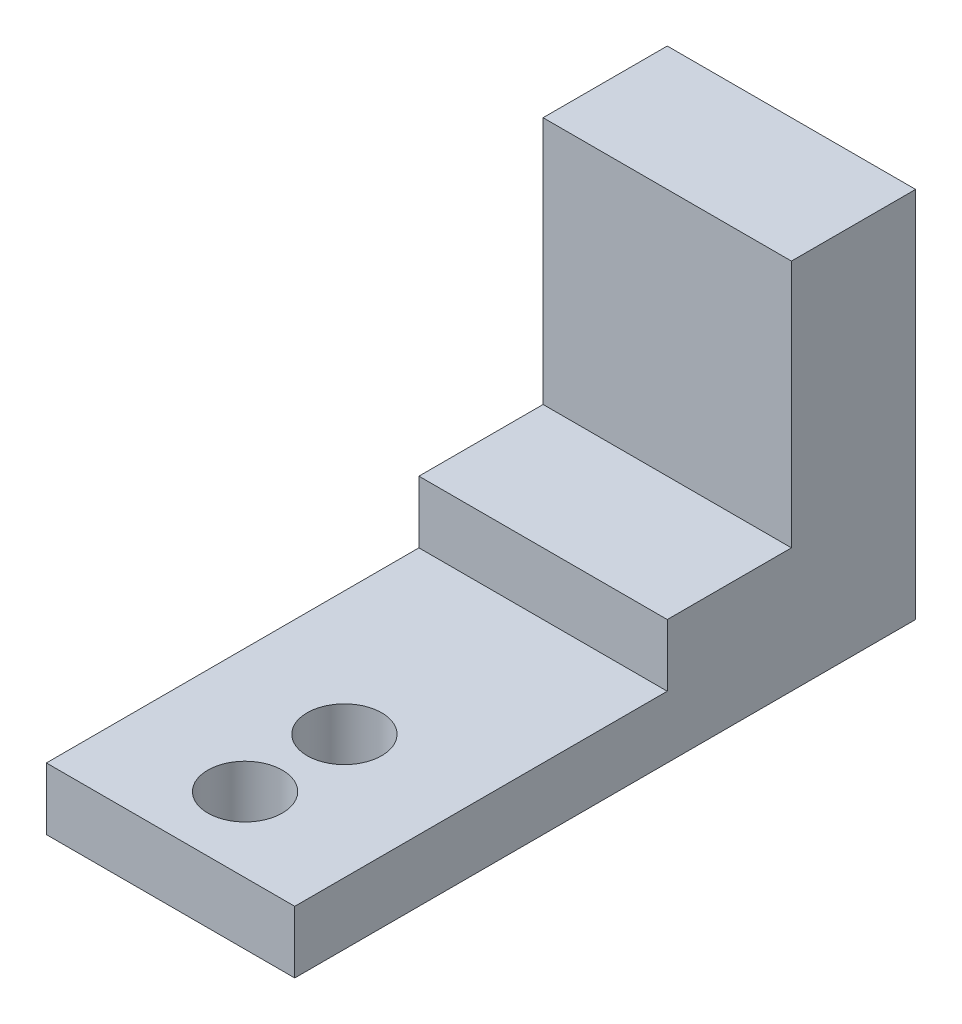
from build123d import *

# Parameters (mm, degrees)
SKETCH1_W           = 10
SKETCH1_H           = 2.5
BOSS_EXTRUDE1_DEPTH = 15
SKETCH2_R           = 1.5
CUT_EXTRUDE1_DEPTH  = 15
SKETCH3_W           = 10
SKETCH3_H           = 5
BOSS_EXTRUDE2_DEPTH = 10
SKETCH4_W           = 10
SKETCH4_H           = 5
BOSS_EXTRUDE3_DEPTH = 10


with BuildPart() as part:
    # Sketch1 → Boss-Extrude1 (new body)
    with BuildSketch(Plane.XY):
        with Locations((5, -1.25)):
            Rectangle(SKETCH1_W, SKETCH1_H)
    extrude(amount=BOSS_EXTRUDE1_DEPTH)

    # Sketch2 → Cut-Extrude1 (cut)
    with BuildSketch(Plane(origin=(0, 0, 0), x_dir=(1, 0, 0), z_dir=(0, 1, 0))):
        with Locations(Location((5, -12, 0), (0, 0, 270))):
            Circle(SKETCH2_R)
        with Locations(Location((5, -8, 0), (0, 0, 270))):
            Circle(SKETCH2_R)
    extrude(amount=-CUT_EXTRUDE1_DEPTH, mode=Mode.SUBTRACT)

    # Sketch3 → Boss-Extrude2 (add)
    with BuildSketch(Plane(origin=(0, 0, 0), x_dir=(-1, 0, 0), z_dir=(0, 0, -1))):
        with Locations((-5, 0)):
            Rectangle(SKETCH3_W, SKETCH3_H)
    extrude(amount=BOSS_EXTRUDE2_DEPTH)

    # Sketch4 → Boss-Extrude3 (add)
    with BuildSketch(Plane(origin=(0, 2.5, 0), x_dir=(1, 0, 0), z_dir=(0, 1, 0))):
        with Locations((5, 7.5)):
            Rectangle(SKETCH4_W, SKETCH4_H)
    extrude(amount=BOSS_EXTRUDE3_DEPTH)


solid = part.part
